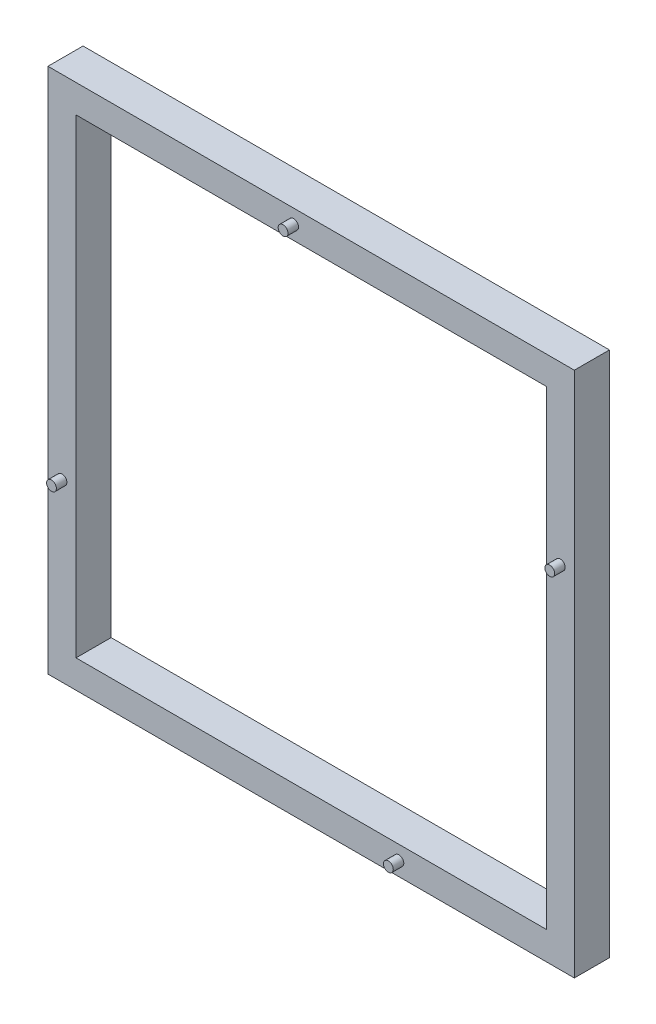
from build123d import *

# Parameters (mm, degrees)
SKETCH1_W           = 150
SKETCH1_H           = 150
BOSS_EXTRUDE1_DEPTH = 10
SKETCH2_W           = 134
SKETCH2_H           = 134
CUT_EXTRUDE1_DEPTH  = 139.158896854
SKETCH3_R           = 1.4
BOSS_EXTRUDE2_DEPTH = 3


with BuildPart() as part:
    # Sketch1 → Boss-Extrude1 (new body)
    with BuildSketch(Plane.XY):
        with Locations((2.789256198, -38.739669421)):
            Rectangle(SKETCH1_W, SKETCH1_H)
    extrude(amount=BOSS_EXTRUDE1_DEPTH)

    # Sketch2 → Cut-Extrude1 (cut, through all)
    with BuildSketch(Plane.XY.offset(10)):
        with Locations((2.789256198, -38.739669421)):
            Rectangle(SKETCH2_W, SKETCH2_H)
    extrude(amount=-CUT_EXTRUDE1_DEPTH, mode=Mode.SUBTRACT)

    # Sketch3 → Boss-Extrude2 (add)
    with BuildSketch(Plane.XY.offset(10)):
        with Locations((73.789256198, -13.739669421)):
            Circle(SKETCH3_R)
        with Locations((27.789256198, -109.739669421)):
            Circle(SKETCH3_R)
        with Locations((-68.210743802, -63.739669421)):
            Circle(SKETCH3_R)
        with Locations((-2.210743802, 32.260330579)):
            Circle(SKETCH3_R)
    extrude(amount=BOSS_EXTRUDE2_DEPTH)


solid = part.part
